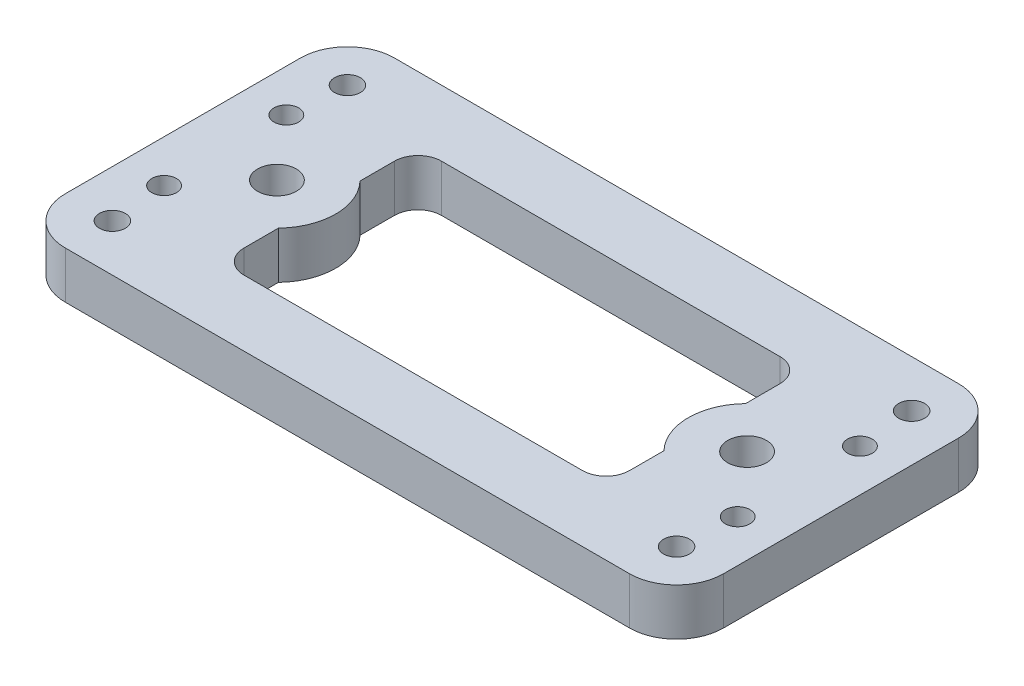
from build123d import *

# Parameters (mm, degrees)
SKETCH1_W           = 140
SKETCH1_H           = 70
SKETCH1_W_2         = 82
SKETCH1_H_2         = 42
BOSS_EXTRUDE1_DEPTH = 10
FILLET1_R           = 10
SKETCH2_R           = 2.75
CUT_EXTRUDE1_DEPTH  = 79.89866919
SKETCH3_R           = 4.125
CUT_EXTRUDE2_DEPTH  = 79.89866919
BOSS_EXTRUDE2_DEPTH = 10
FILLET2_R           = 5
SKETCH5_R           = 2.625
CUT_EXTRUDE3_DEPTH  = 79.89866919


with BuildPart() as part:
    # Sketch1 → Boss-Extrude1 (new body)
    with BuildSketch(Plane(origin=(0, 0, 0), x_dir=(1, 0, 0), z_dir=(0, 1, 0))):
        Rectangle(SKETCH1_W, SKETCH1_H)
        Rectangle(SKETCH1_W_2, SKETCH1_H_2, mode=Mode.SUBTRACT)
    extrude(amount=BOSS_EXTRUDE1_DEPTH)

    # Fillet1
    fillet1_edges = [part.edges().sort_by_distance(p)[0] for p in [
        (70, 5, 35),
        (-70, 5, 35),
        (-70, 5, -35),
        (70, 5, -35),
    ]]
    fillet(fillet1_edges, radius=FILLET1_R)

    # Sketch2 → Cut-Extrude1 (cut, through all)
    with BuildSketch(Plane(origin=(0, 10, 0), x_dir=(1, 0, 0), z_dir=(0, 1, 0))):
        with Locations(Location((-60, -25, 0), (0, 0, 270))):
            Circle(SKETCH2_R)
        with Locations(Location((-60, 25, 0), (0, 0, 90))):
            Circle(SKETCH2_R)
        with Locations(Location((60, -25, 0), (0, 0, 90))):
            Circle(SKETCH2_R)
        with Locations(Location((60, 25, 0), (0, 0, 270))):
            Circle(SKETCH2_R)
    extrude(amount=-CUT_EXTRUDE1_DEPTH, mode=Mode.SUBTRACT)

    # Sketch3 → Cut-Extrude2 (cut, through all)
    with BuildSketch(Plane(origin=(0, 10, 0), x_dir=(1, 0, 0), z_dir=(0, 1, 0))):
        with Locations(Location((-50, 0, 0), (0, 0, 270))):
            Circle(SKETCH3_R)
        with Locations(Location((50, 0, 0), (0, 0, 90))):
            Circle(SKETCH3_R)
    extrude(amount=-CUT_EXTRUDE2_DEPTH, mode=Mode.SUBTRACT)

    # Sketch4 → Boss-Extrude2 (add)
    with BuildSketch(Plane(origin=(0, 10, 0), x_dir=(1, 0, 0), z_dir=(0, 1, 0))):
        with BuildLine():
            Line((-41, 8.674675786), (-41, -8.674675786))
            ThreePointArc((-41, -8.674675786), (-37.5, 0), (-41, 8.674675786))
        make_face()
        with BuildLine():
            Line((41, 8.674675786), (41, -8.674675786))
            ThreePointArc((41, -8.674675786), (37.5, 0), (41, 8.674675786))
        make_face()
    extrude(amount=-BOSS_EXTRUDE2_DEPTH)

    # Fillet2
    fillet2_edges = [part.edges().sort_by_distance(p)[0] for p in [
        (41, 5, 21),
        (41, 5, -21),
        (-41, 5, -21),
        (-41, 5, 21),
    ]]
    fillet(fillet2_edges, radius=FILLET2_R)

    # Sketch5 → Cut-Extrude3 (cut, through all)
    with BuildSketch(Plane(origin=(0, 10, 0), x_dir=(1, 0, 0), z_dir=(0, 1, 0))):
        with Locations(Location((-61, 13, 0), (0, 0, 270))):
            Circle(SKETCH5_R)
        with Locations(Location((-61, -13, 0), (0, 0, 270))):
            Circle(SKETCH5_R)
        with Locations(Location((61, 13, 0), (0, 0, 270))):
            Circle(SKETCH5_R)
        with Locations(Location((61, -13, 0), (0, 0, 270))):
            Circle(SKETCH5_R)
    extrude(amount=-CUT_EXTRUDE3_DEPTH, mode=Mode.SUBTRACT)


solid = part.part
